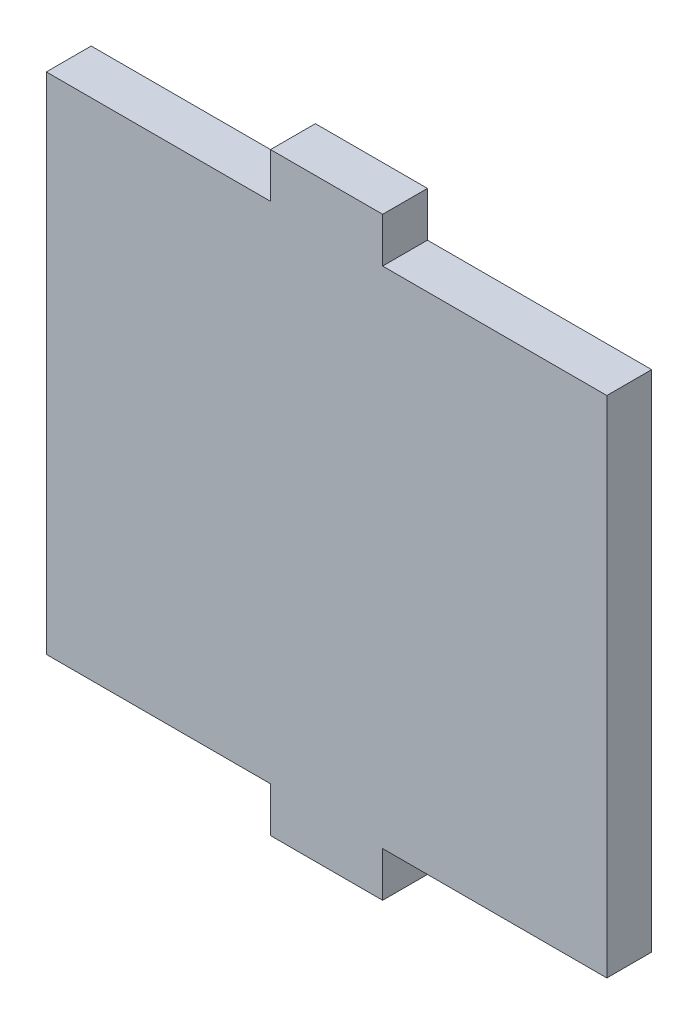
from build123d import *

# Parameters (mm, degrees)
BOSS_EXTRU_1_DEPTH = 4


with BuildPart() as part:
    # Esquisse1 → Boss.-Extru.1 (new body)
    with BuildSketch(Plane.XY):
        Polygon((50, 0), (50, -45), (30, -45), (30, -49), (20, -49), (20, -45), (0, -45), (0, 0), (20, 0), (20, 4), (30, 4), (30, 0), align=None)
    extrude(amount=BOSS_EXTRU_1_DEPTH)


solid = part.part
